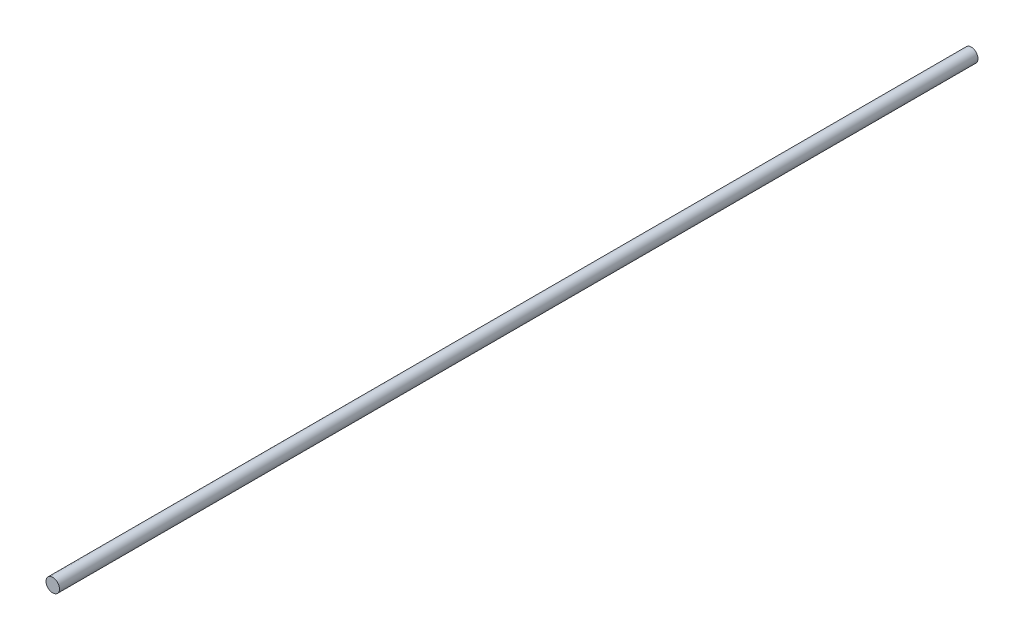
from build123d import *

# Parameters (mm, degrees)
SKETCH1_R           = 4
BOSS_EXTRUDE1_DEPTH = 544


with BuildPart() as part:
    # Sketch1 → Boss-Extrude1 (new body)
    with BuildSketch(Plane.XY):
        Circle(SKETCH1_R)
    extrude(amount=BOSS_EXTRUDE1_DEPTH)


solid = part.part
